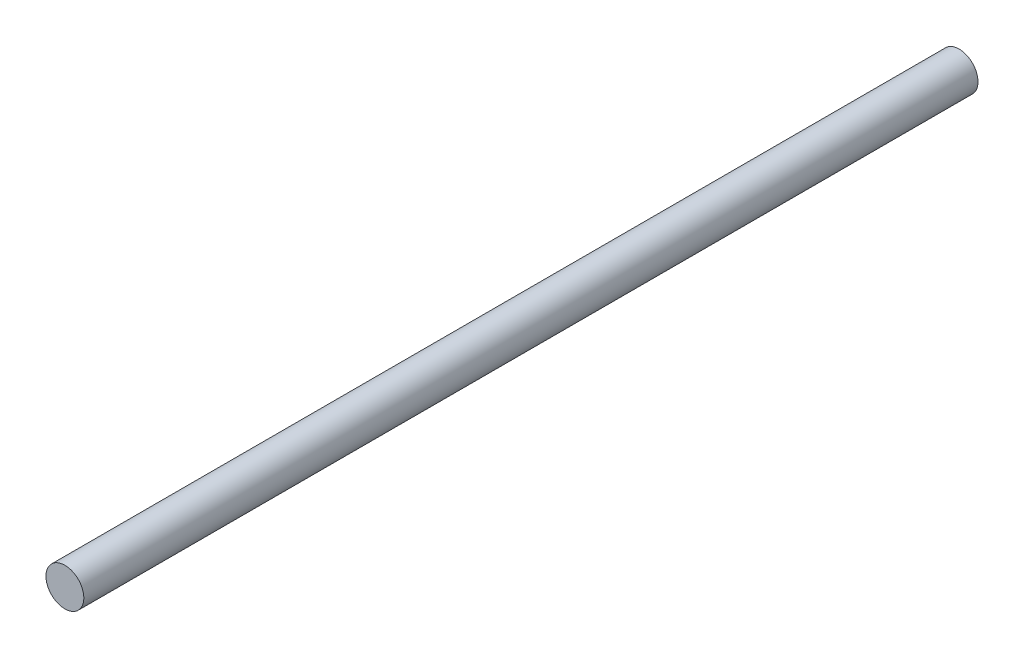
from build123d import *

# Parameters (mm, degrees)
SKETCH1_R           = 3.175
BOSS_EXTRUDE1_DEPTH = 150


with BuildPart() as part:
    # Sketch1 → Boss-Extrude1 (new body)
    with BuildSketch(Plane.XY):
        Circle(SKETCH1_R)
    extrude(amount=BOSS_EXTRUDE1_DEPTH)


solid = part.part
